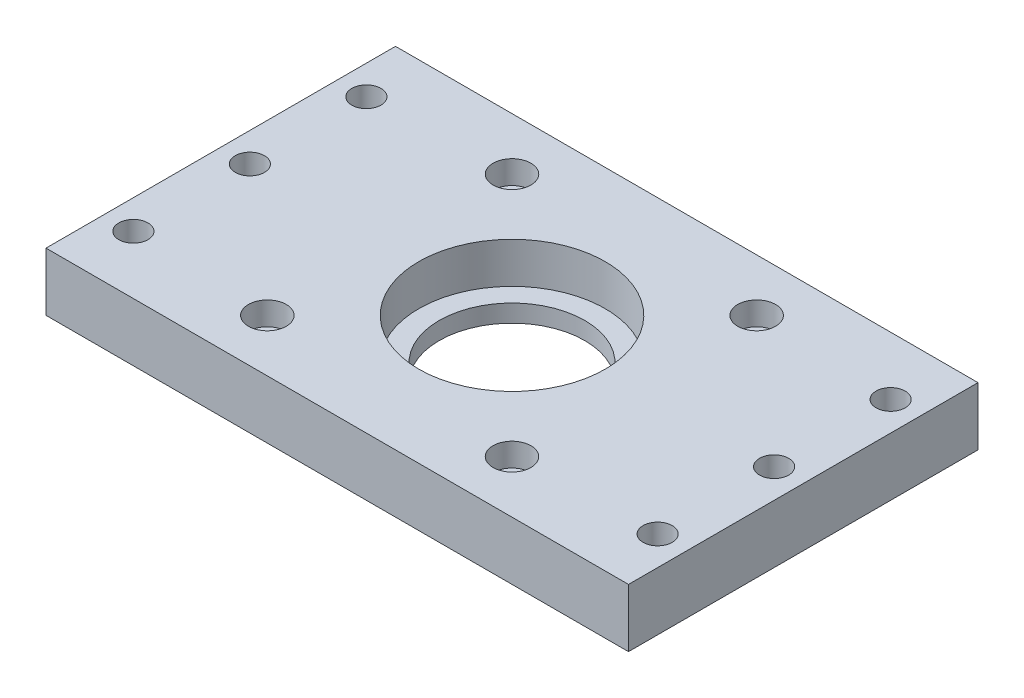
from build123d import *

# Parameters (mm, degrees)
SKETCH1_W           = 100
SKETCH1_H           = 60
BOSS_EXTRUDE1_DEPTH = 10
SKETCH2_R           = 2.5
CUT_EXTRUDE1_DEPTH  = 60.160797831
SKETCH3_R           = 16
CUT_EXTRUDE2_DEPTH  = 7
SKETCH4_R           = 12.5
CUT_EXTRUDE3_DEPTH  = 59.72818744
SKETCH5_R           = 1.5
CUT_EXTRUDE4_DEPTH  = 60.160797831
SKETCH6_R           = 3.25
CUT_EXTRUDE5_DEPTH  = 4
CIRPATTERN1_COUNT   = 4


with BuildPart() as part:
    # Sketch1 → Boss-Extrude1 (new body)
    with BuildSketch(Plane(origin=(0, 0, 0), x_dir=(1, 0, 0), z_dir=(0, 1, 0))):
        Rectangle(SKETCH1_W, SKETCH1_H)
    extrude(amount=BOSS_EXTRUDE1_DEPTH)

    # Sketch2 → Cut-Extrude1 (cut, through all)
    with BuildSketch(Plane(origin=(0, 10, 0), x_dir=(1, 0, 0), z_dir=(0, 1, 0))):
        with Locations(Location((-45, -20, 0), (0, 0, 270))):
            Circle(SKETCH2_R)
        with Locations(Location((-45, 0, 0), (0, 0, 270))):
            Circle(SKETCH2_R)
        with Locations(Location((-45, 20, 0), (0, 0, 270))):
            Circle(SKETCH2_R)
    cut_extrude1 = extrude(amount=-CUT_EXTRUDE1_DEPTH, mode=Mode.SUBTRACT)

    # Mirror1: Cut-Extrude1 across plane
    add(cut_extrude1.mirror(Plane(origin=(0, 0, 0), x_dir=(0, 0, 1), z_dir=(1, 0, 0))), mode=Mode.SUBTRACT)

    # Sketch3 → Cut-Extrude2 (cut)
    with BuildSketch(Plane(origin=(0, 10, 0), x_dir=(1, 0, 0), z_dir=(0, 1, 0))):
        with Locations(Location((0, 0, 0), (0, 0, 270))):
            Circle(SKETCH3_R)
    extrude(amount=-CUT_EXTRUDE2_DEPTH, mode=Mode.SUBTRACT)

    # Sketch4 → Cut-Extrude3 (cut, through all)
    with BuildSketch(Plane(origin=(0, 3, 0), x_dir=(1, 0, 0), z_dir=(0, 1, 0))):
        with Locations(Location((0, 0, 0), (0, 0, 270))):
            Circle(SKETCH4_R)
    extrude(amount=-CUT_EXTRUDE3_DEPTH, mode=Mode.SUBTRACT)

    # Sketch5 → Cut-Extrude4 (cut, through all)
    with BuildSketch(Plane(origin=(0, 10, 0), x_dir=(1, 0, 0), z_dir=(0, 1, 0))):
        with Locations(Location((-21, 21, 0), (0, 0, 270))):
            Circle(SKETCH5_R)
    cut_extrude4 = extrude(amount=-CUT_EXTRUDE4_DEPTH, mode=Mode.SUBTRACT)

    # Sketch6 → Cut-Extrude5 (cut)
    with BuildSketch(Plane(origin=(0, 10, 0), x_dir=(1, 0, 0), z_dir=(0, 1, 0))):
        with Locations(Location((-21, 21, 0), (0, 0, 270))):
            Circle(SKETCH6_R)
    cut_extrude5 = extrude(amount=-CUT_EXTRUDE5_DEPTH, mode=Mode.SUBTRACT)

    # CirPattern1: Cut-Extrude4, Cut-Extrude5 ×4 about axis
    cirpattern1_axis = Axis((0, 0, 0), (0, 1, 0))
    add([cut_extrude4.rotate(cirpattern1_axis, i * 360 / CIRPATTERN1_COUNT) for i in range(1, CIRPATTERN1_COUNT)], mode=Mode.SUBTRACT)
    add([cut_extrude5.rotate(cirpattern1_axis, i * 360 / CIRPATTERN1_COUNT) for i in range(1, CIRPATTERN1_COUNT)], mode=Mode.SUBTRACT)


solid = part.part
